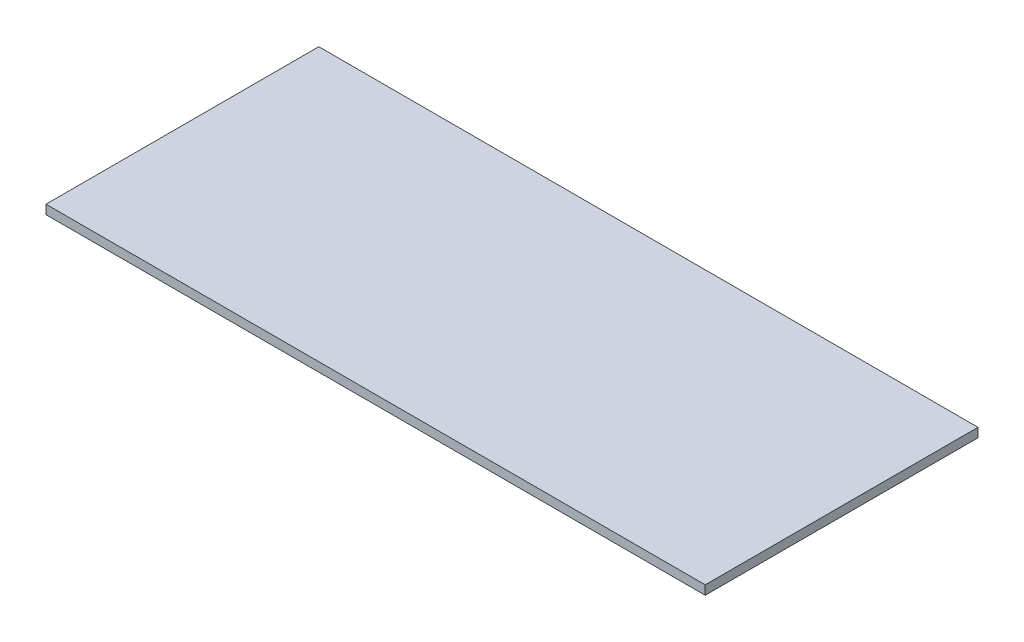
from build123d import *

# Parameters (mm, degrees)
SKETCH1_W           = 145
SKETCH1_H           = 60
BOSS_EXTRUDE1_DEPTH = 1


with BuildPart() as part:
    # Sketch1 → Boss-Extrude1 (new, symmetric)
    with BuildSketch(Plane(origin=(0, 0, 0), x_dir=(1, 0, 0), z_dir=(0, 1, 0))):
        Rectangle(SKETCH1_W, SKETCH1_H)
    extrude(amount=BOSS_EXTRUDE1_DEPTH, both=True)


solid = part.part
